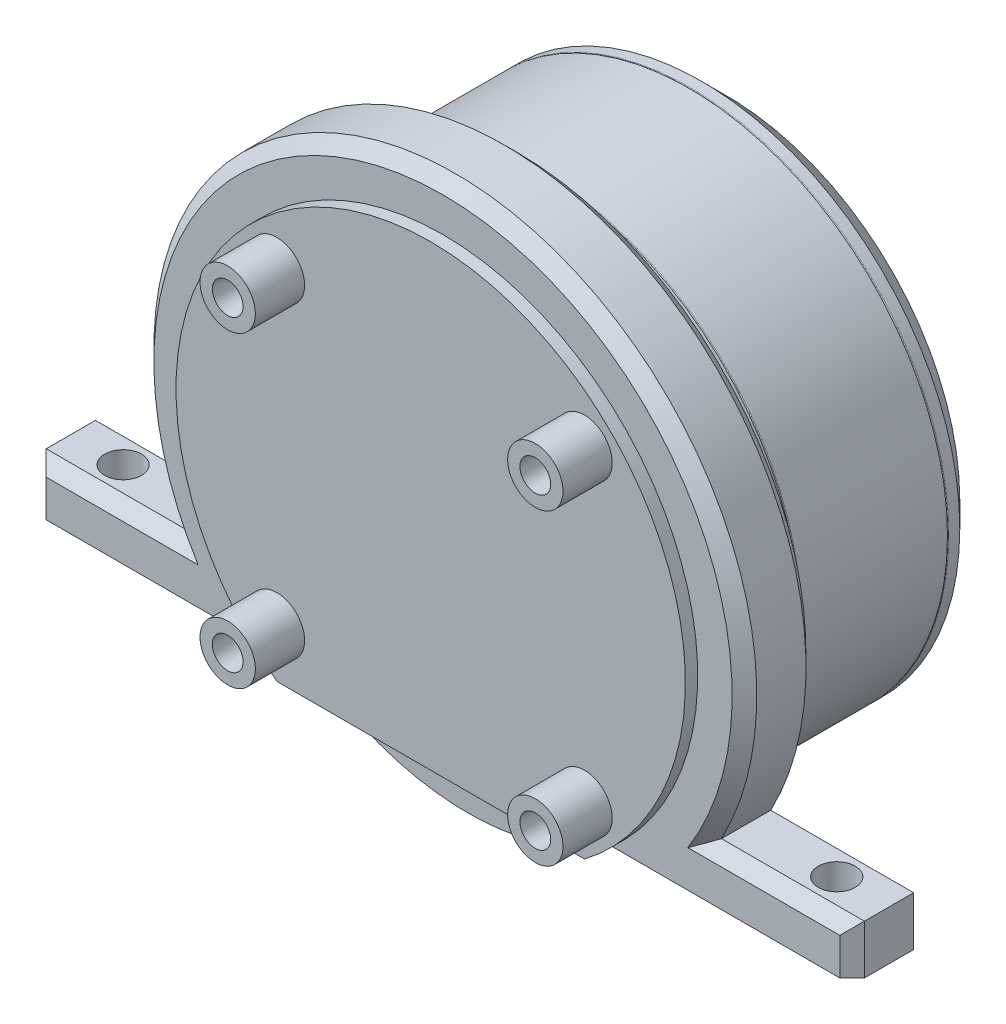
from build123d import *

# Parameters (mm, degrees)
SKETCH1_R               = 21
BOSS_EXTRUDE1_DEPTH     = 3
CHAMFER1_SIZE           = 2
FILLET1_R               = 0.1
SKETCH2_R               = 21
BOSS_EXTRUDE2_DEPTH     = 12
FILLET2_R               = 0.1
SKETCH3_R               = 21
BOSS_EXTRUDE3_DEPTH     = 6
SKETCH4_R               = 3
SKETCH4_R_2             = 1.5
CUT_EXTRUDE1_DEPTH      = 6
BOSS_EXTRUDE4_DEPTH     = 6
CHAMFER2_SIZE           = 1
CUT_EXTRUDE2_DEPTH      = 55.134670037
CUT_EXTRUDE2_DEPTH_BACK = 55.134670037
SKETCH6_R               = 1.5
BOSS_EXTRUDE5_DEPTH     = 1
SKETCH8_R               = 2.25
BOSS_EXTRUDE6_DEPTH     = 4
SKETCH9_R               = 1.25
CUT_EXTRUDE3_DEPTH      = 4


with BuildPart() as part:
    # Sketch1 → Boss-Extrude1 (new body)
    with BuildSketch(Plane.XY):
        Circle(SKETCH1_R)
    extrude(amount=BOSS_EXTRUDE1_DEPTH)

    # Chamfer1
    chamfer1_edges = [part.edges().sort_by_distance(p)[0] for p in [
        (-21, 0, 0),
    ]]
    chamfer(chamfer1_edges, length=CHAMFER1_SIZE)

    # Fillet1
    fillet1_edges = [part.edges().sort_by_distance(p)[0] for p in [
        (-21, 0, 3),
    ]]
    fillet(fillet1_edges, radius=FILLET1_R)

    # Sketch2 → Boss-Extrude2 (add)
    with BuildSketch(Plane.XY.offset(3)):
        Circle(SKETCH2_R)
    extrude(amount=BOSS_EXTRUDE2_DEPTH)

    # Fillet2
    fillet2_edges = [part.edges().sort_by_distance(p)[0] for p in [
        (-21, 0, 15),
    ]]
    fillet(fillet2_edges, radius=FILLET2_R)

    # Sketch3 → Boss-Extrude3 (add)
    with BuildSketch(Plane.XY.offset(15)):
        Circle(SKETCH3_R)
    extrude(amount=BOSS_EXTRUDE3_DEPTH)

    # Sketch4 → Cut-Extrude1 (cut)
    with BuildSketch(Plane(origin=(0, 0, 0), x_dir=(-1, 0, 0), z_dir=(0, 0, -1))):
        Circle(SKETCH4_R)
        with Locations((-10, 0)):
            Circle(SKETCH4_R_2)
        with Locations((0, 10)):
            Circle(SKETCH4_R_2)
        with Locations((10, 0)):
            Circle(SKETCH4_R_2)
        with Locations((0, -10)):
            Circle(SKETCH4_R_2)
    extrude(amount=-CUT_EXTRUDE1_DEPTH, mode=Mode.SUBTRACT)

    # Sketch5 → Boss-Extrude4 (add)
    with BuildSketch(Plane.XY.offset(17)):
        with BuildLine():
            Line((21.633307653, -11.5), (33.25, -11.5))
            Line((33.25, -11.5), (33.25, -15.5))
            Line((33.25, -15.5), (-33.25, -15.5))
            Line((-33.25, -15.5), (-33.25, -11.5))
            Line((-33.25, -11.5), (-21.633307653, -11.5))
            ThreePointArc((-21.633307653, -11.5), (0, 24.5), (21.633307653, -11.5))
        make_face()
    extrude(amount=BOSS_EXTRUDE4_DEPTH)

    # Chamfer2
    chamfer2_edges = [part.edges().sort_by_distance(p)[0] for p in [
        (0, 24.5, 17),
        (-27.441653826, -11.5, 17),
        (-33.25, -13.5, 17),
        (33.25, -13.5, 17),
        (27.441653826, -11.5, 17),
        (0, 24.5, 23),
        (-27.441653826, -11.5, 23),
        (-33.25, -13.5, 23),
        (33.25, -13.5, 23),
        (27.441653826, -11.5, 23),
    ]]
    chamfer(chamfer2_edges, length=CHAMFER2_SIZE)

    # Sketch6 → Cut-Extrude2 (cut, two sides: drawn at the far end of the back side and taken through both)
    with BuildSketch(Plane(origin=(0, -11.5, 0), x_dir=(1, 0, 0), z_dir=(0, 1, 0)).offset(-CUT_EXTRUDE2_DEPTH_BACK)):
        with Locations(Location((-29, -20, 0), (0, 0, 180))):
            Circle(SKETCH6_R)
        with Locations(Location((29, -20, 0), (0, 0, 180))):
            Circle(SKETCH6_R)
    extrude(amount=CUT_EXTRUDE2_DEPTH + CUT_EXTRUDE2_DEPTH_BACK, mode=Mode.SUBTRACT)

    # Sketch7 → Boss-Extrude5 (add)
    with BuildSketch(Plane.XY.offset(23)):
        with BuildLine():
            Line((12.499599994, -16.5), (-12.499599994, -16.5))
            ThreePointArc((-12.499599994, -16.5), (0, 20.7), (12.499599994, -16.5))
        make_face()
    extrude(amount=BOSS_EXTRUDE5_DEPTH)

    # Sketch8 → Boss-Extrude6 (add)
    with BuildSketch(Plane.XY.offset(24)):
        with Locations((-12.5, 12.5)):
            Circle(SKETCH8_R)
        with Locations((12.5, 12.5)):
            Circle(SKETCH8_R)
        with Locations((12.5, -12.5)):
            Circle(SKETCH8_R)
        with Locations((-12.5, -12.5)):
            Circle(SKETCH8_R)
    extrude(amount=BOSS_EXTRUDE6_DEPTH)

    # Sketch9 → Cut-Extrude3 (cut)
    with BuildSketch(Plane.XY.offset(28)):
        with Locations((12.5, 12.5)):
            Circle(SKETCH9_R)
        with Locations((12.5, -12.5)):
            Circle(SKETCH9_R)
        with Locations((-12.5, 12.5)):
            Circle(SKETCH9_R)
        with Locations((-12.5, -12.5)):
            Circle(SKETCH9_R)
    extrude(amount=-CUT_EXTRUDE3_DEPTH, mode=Mode.SUBTRACT)


solid = part.part
